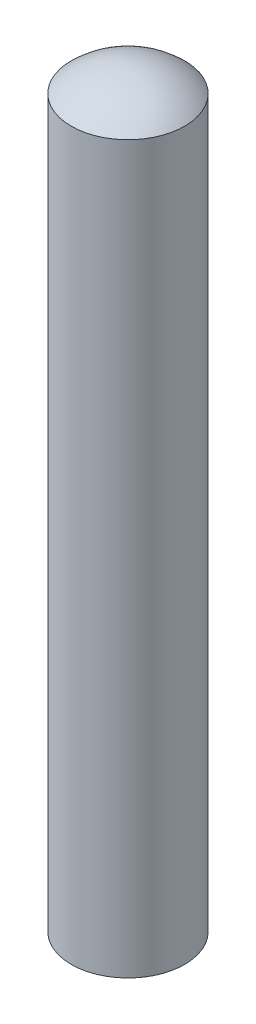
from build123d import *

# Parameters (mm, degrees)
DOME1_FACE_RADIUS = 12.5
DOME1_HEIGHT      = 5


with BuildPart() as part:
    # Sketch1 → Revolve1 (revolve)
    with BuildSketch(Plane.XY, mode=Mode.PRIVATE) as revolve1_sk:
        Polygon((0, 0), (-12.5, 0), (-12.5, 30), (-12.5, 100), (-12.5, 160), (0, 160), align=None)
    revolve(revolve1_sk.sketch.rotate(Axis((0, 160, 0), (0, -1, 0)), 270), axis=Axis((0, 160, 0), (0, -1, 0)))

    # Dome1: a dome of height H over a round flat face of radius A is a cap of a sphere of radius (A * A + H * H) / (2 * H)
    dome1_r = (DOME1_FACE_RADIUS * DOME1_FACE_RADIUS + DOME1_HEIGHT * DOME1_HEIGHT) / (2 * DOME1_HEIGHT)
    dome1_base = Plane((0, 160, 0), z_dir=(0, 1, 0))
    with Locations(dome1_base.offset(DOME1_HEIGHT - dome1_r)):
        dome1_ball = Sphere(dome1_r, mode=Mode.PRIVATE)
    add(split(dome1_ball, bisect_by=dome1_base, keep=Keep.TOP, mode=Mode.PRIVATE))


solid = part.part
